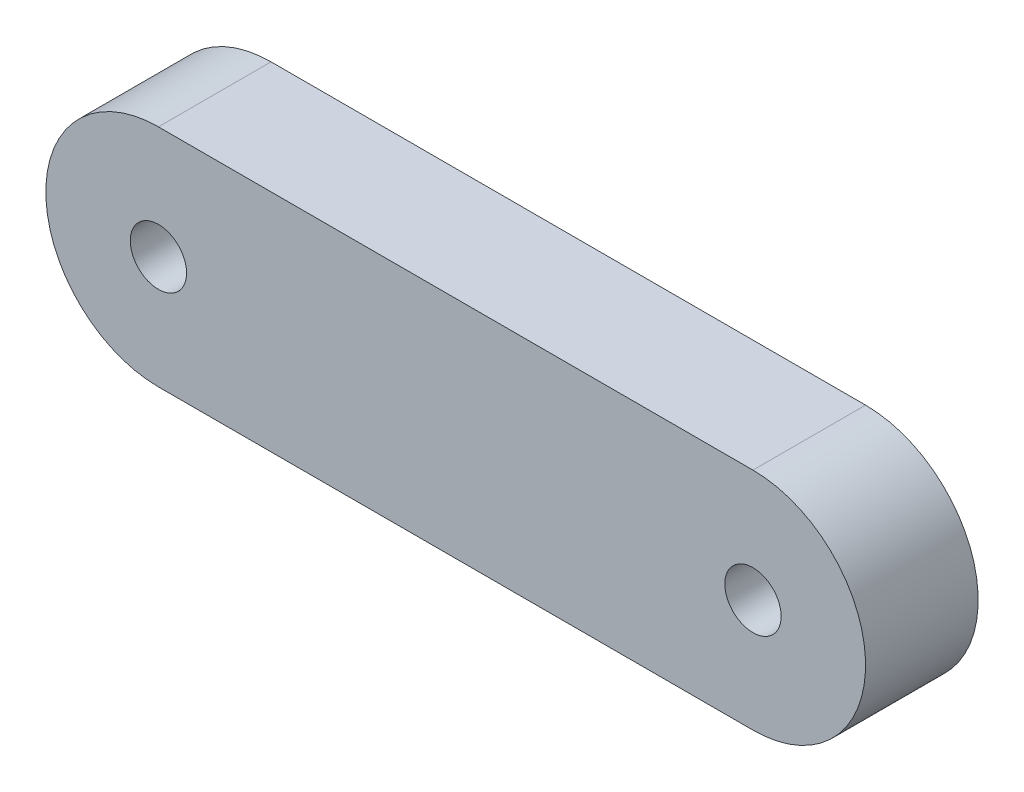
from build123d import *

# Parameters (mm, degrees)
SKETCH1_R           = 6.35
SKETCH1_R_2         = 1.5875
BOSS_EXTRUDE1_DEPTH = 6.35


with BuildPart() as part:
    # Sketch1 → Boss-Extrude1 (new body)
    # profile 1 of 3: a face of its own
    with BuildSketch(Plane.XY):
        with BuildLine():
            Line((33.528, 6.35), (0, 6.35))
            ThreePointArc((0, 6.35), (4.490128061, 4.490128061), (6.35, 0))
            ThreePointArc((6.35, 0), (4.490128061, -4.490128061), (0, -6.35))
            Line((0, -6.35), (33.528, -6.35))
            ThreePointArc((33.528, -6.35), (27.178, 0), (33.528, 6.35))
        make_face()
    # profile 2 of 3: a face of its own
    with BuildSketch(Plane.XY):
        Circle(SKETCH1_R)
        Circle(SKETCH1_R_2, mode=Mode.SUBTRACT)
    # profile 3 of 3: a face of its own
    with BuildSketch(Plane.XY):
        with Locations((33.528, 0)):
            Circle(SKETCH1_R)
        with Locations((33.528, 0)):
            Circle(SKETCH1_R_2, mode=Mode.SUBTRACT)
    extrude(amount=BOSS_EXTRUDE1_DEPTH)


solid = part.part
